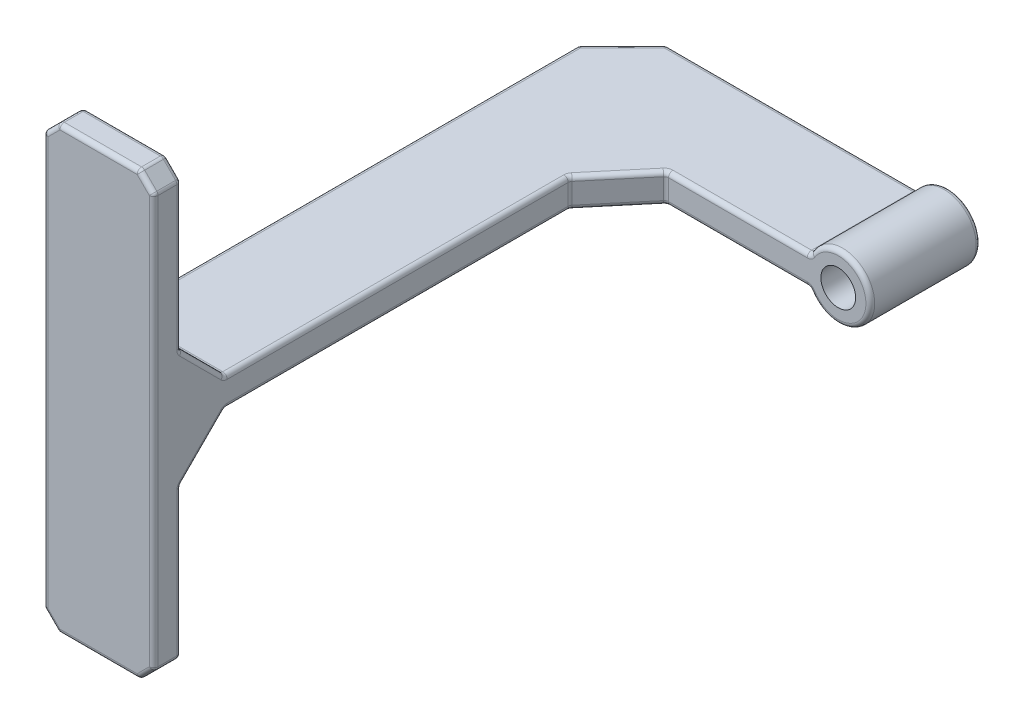
from build123d import *

# Parameters (mm, degrees)
BOSS_EXTRUDE1_DEPTH      = 2.54
BOSS_EXTRUDE1_DEPTH_BACK = 2.54
SKETCH2_W                = 19.05
SKETCH2_H                = 76.2
BOSS_EXTRUDE2_DEPTH      = 4.7625
CHAMFER1_SIZE            = 7.62
SKETCH3_W                = 2.54
SKETCH3_H                = 19.05
BOSS_EXTRUDE3_REACH      = 116.476
SKETCH4_W                = 19.05
SKETCH4_H                = 5.08
CHAMFER2_SIZE            = 7.62
CHAMFER3_SIZE            = 7.62
CHAMFER3_SIZE2           = 9.081162376
CHAMFER4_SIZE            = 2.54
FILLET2_R                = 0.762


with BuildPart() as part:
    # Sketch1 → Boss-Extrude1 (new, two sides: drawn at the far end of the back side and taken through both)
    with BuildSketch(Plane(origin=(0, 0, 0), x_dir=(1, 0, 0), z_dir=(0, 1, 0)).offset(-BOSS_EXTRUDE1_DEPTH_BACK)):
        Polygon((-25.719899244, 0), (-25.719899244, 95.25), (25.080100756, 95.25), (25.080100756, 76.2), (-6.669899244, 76.2), (-6.669899244, 0), align=None)
    extrude(amount=BOSS_EXTRUDE1_DEPTH + BOSS_EXTRUDE1_DEPTH_BACK)

    # Sketch2 → Boss-Extrude2 (add)
    with BuildSketch(Plane.XY):
        with Locations((-16.194899244, 0)):
            Rectangle(SKETCH2_W, SKETCH2_H)
    extrude(amount=BOSS_EXTRUDE2_DEPTH)

    # Chamfer1
    chamfer1_edges = [part.edges().sort_by_distance(p)[0] for p in [
        (-16.194899244, 2.54, 0),
        (-16.194899244, -2.54, 0),
    ]]
    chamfer(chamfer1_edges, length=CHAMFER1_SIZE)


with BuildPart() as body_2:
    # Sketch3 → Revolve1 (revolve)
    with BuildSketch(Plane(origin=(0, 0, 0), x_dir=(1, 0, 0), z_dir=(0, 1, 0))):
        with Locations((26.350100756, 85.725)):
            Rectangle(SKETCH3_W, SKETCH3_H)
    revolve(axis=Axis((30.620100756, 0, -76.2), (0, 0, -1)))

    # Boss-Extrude3: up to this face of the body
    boss_extrude3_end = body_2.part.faces().sort_by_distance((36.160100756, 0, -85.725))[0]
    # Sketch4 → Boss-Extrude3 (add, up to the picked face)
    with BuildSketch(Plane(origin=(25.080100756, 0, 0), x_dir=(0, 0, -1), z_dir=(1, 0, 0)), mode=Mode.PRIVATE) as boss_extrude3_sk1:
        with Locations((85.725, 0)):
            Rectangle(SKETCH4_W, SKETCH4_H)
    boss_extrude3_tool1 = split(extrude(boss_extrude3_sk1.sketch, amount=BOSS_EXTRUDE3_REACH, mode=Mode.PRIVATE), bisect_by=boss_extrude3_end, keep=Keep.BOTH, mode=Mode.PRIVATE)

    add(part.part)  # Boss-Extrude3 merges part
    add(boss_extrude3_tool1.solids().sort_by(Axis((25.080101, 0, -85.725), (1, 0, 0)))[0])
    add(boss_extrude3_tool1.solids().sort_by(Axis((25.080101, 0, -85.725), (1, 0, 0)))[1])

    # Chamfer2
    chamfer2_edges = [body_2.edges().sort_by_distance(p)[0] for p in [
        (-25.719899244, 0, -95.25),
    ]]
    chamfer(chamfer2_edges, length=CHAMFER2_SIZE)

    # Chamfer3
    chamfer3_edges = [body_2.edges().sort_by_distance(p)[0] for p in [
        (-6.669899244, 0, -76.2),
    ]]
    chamfer3_side = [body_2.faces().sort_by_distance(p)[0] for p in [
        (15.608602047, 0, -76.2),
    ]]
    chamfer(chamfer3_edges, length=CHAMFER3_SIZE, length2=CHAMFER3_SIZE2, reference=chamfer3_side[0])

    # Chamfer4
    chamfer4_edges = [body_2.edges().sort_by_distance(p)[0] for p in [
        (-6.669899244, 38.1, 2.38125),
        (-25.719899244, 38.1, 2.38125),
        (-25.719899244, -38.1, 2.38125),
        (-6.669899244, -38.1, 2.38125),
    ]]
    chamfer(chamfer4_edges, length=CHAMFER4_SIZE)

    # Fillet2
    fillet2_edges = [body_2.edges().sort_by_distance(p)[0] for p in [
        (-9.209899244, -38.1, 2.38125),
        (-7.939899244, -36.83, 4.7625),
        (-16.194899244, -38.1, 4.7625),
        (-16.194899244, -38.1, 0),
        (-23.179899244, -38.1, 2.38125),
        (-6.669899244, -35.56, 2.38125),
        (-7.939899244, -36.83, 0),
        (-7.939899244, 36.83, 4.7625),
        (-6.669899244, 0, 4.7625),
        (-24.449899244, -36.83, 4.7625),
        (-16.194899244, 38.1, 4.7625),
        (-9.209899244, 38.1, 2.38125),
        (-25.719899244, -35.56, 2.38125),
        (-24.449899244, -36.83, 0),
        (-6.669899244, -22.86, 0),
        (-6.669899244, 35.56, 2.38125),
        (-7.939899244, 36.83, 0),
        (-25.719899244, 0, 4.7625),
        (-24.449899244, 36.83, 4.7625),
        (-23.179899244, 38.1, 2.38125),
        (-16.194899244, 38.1, 0),
        (-16.194899244, -10.16, 0),
        (-25.719899244, -22.86, 0),
        (-6.669899244, -6.35, -3.81),
        (-6.669899244, 22.86, 0),
        (-25.719899244, 35.56, 2.38125),
        (-24.449899244, 36.83, 0),
        (-6.669899244, -2.54, -37.369418812),
        (-25.719899244, -6.35, -3.81),
        (-16.194899244, -2.54, -7.62),
        (-6.669899244, 6.35, -3.81),
        (-16.194899244, 10.16, 0),
        (-25.719899244, 22.86, 0),
        (-6.669899244, 2.54, -37.369418812),
        (-6.669899244, 0, -67.118837624),
        (-2.859899244, -2.54, -71.659418812),
        (-25.719899244, -2.54, -47.625),
        (-16.194899244, 2.54, -7.62),
        (-25.719899244, 6.35, -3.81),
        (0.950100756, 0, -76.2),
        (-2.859899244, 2.54, -71.659418812),
        (13.323394031, -2.54, -76.2),
        (-21.909899244, -2.54, -91.44),
        (-25.719899244, 0, -87.63),
        (-25.719899244, 2.54, -47.625),
        (36.160100756, 0, -76.2),
        (13.323394031, 2.54, -76.2),
        (25.696687306, -2.54, -85.725),
        (3.798394031, -2.54, -95.25),
        (-18.099899244, 0, -95.25),
        (-21.909899244, 2.54, -91.44),
        (25.696687306, 2.54, -85.725),
        (36.160100756, 0, -95.25),
        (3.798394031, 2.54, -95.25),
    ]]
    fillet(fillet2_edges, radius=FILLET2_R)


solid = body_2.part
